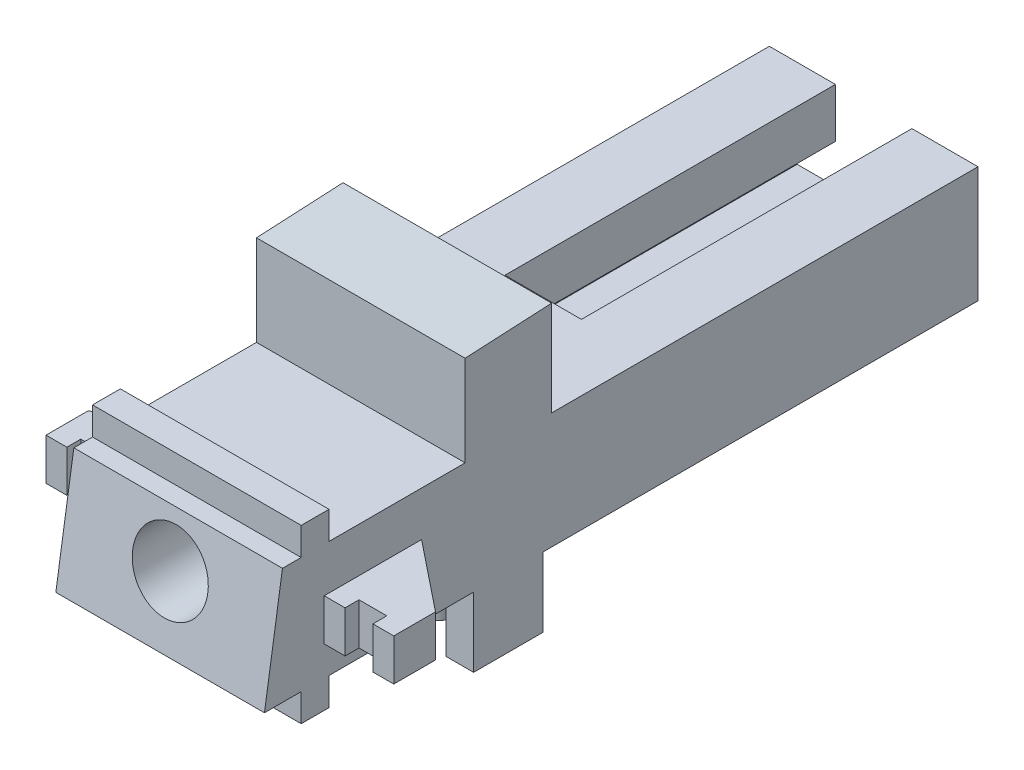
from build123d import *

# Parameters (mm, degrees)
SKETCH9_W               = 15
SKETCH9_H               = 8.35
BOSS_EXTRUDE4_DEPTH     = 50
CUT_EXTRUDE4_DEPTH      = 23.76
BOSS_EXTRUDE9_DEPTH     = 15
CUT_EXTRUDE5_REACH      = 31.734
SKETCH10_R              = 2.7
SKETCH12_W              = 3
SKETCH12_H              = 3
BOSS_EXTRUDE5_DEPTH     = 5
SKETCH13_W              = 2
SKETCH13_H              = 3
CUT_EXTRUDE6_DEPTH      = 1
BOSS_EXTRUDE6_DEPTH     = 3
SKETCH22_W              = 2
SKETCH22_H              = 2
BOSS_EXTRUDE10_DEPTH    = 15
CUT_EXTRUDE7_REACH      = 55.801
CUT_EXTRUDE7_END_RADIUS = 2.7
SKETCH23_R              = 2.5
SKETCH24_W              = 2
SKETCH24_H              = 5
BOSS_EXTRUDE11_DEPTH    = 5
BOSS_EXTRUDE12_DEPTH    = 15


with BuildPart() as part:
    # Sketch9 → Boss-Extrude4 (new body)
    with BuildSketch(Plane.XY):
        with Locations((0, 4.175)):
            Rectangle(SKETCH9_W, SKETCH9_H)
    extrude(amount=BOSS_EXTRUDE4_DEPTH)

    # Sketch7 → Cut-Extrude4 (cut)
    with BuildSketch(Plane.XY):
        Polygon((-5.5, 2), (-5.5, 4.8), (-2.75, 4.8), (-2.75, 8.35), (2.75, 8.35), (2.75, 4.8), (5.5, 4.8), (5.5, 2), align=None)
    extrude(amount=CUT_EXTRUDE4_DEPTH, mode=Mode.SUBTRACT)

    # Sketch21 → Boss-Extrude9 (add)
    with BuildSketch(Plane.ZY.offset(7.5)):
        Polygon((50, 0), (51.294730508, 0), (50, 8.35), align=None)
    extrude(amount=-BOSS_EXTRUDE9_DEPTH)

    # Cut-Extrude5: up to this plane
    cut_extrude5_end = Plane(origin=(15.949782665, 0, 51.294730508), z_dir=(0, 0.15322648630316937, 0.9881910968507989))
    # Sketch10 → Cut-Extrude5 (cut, up to the surface)
    with BuildSketch(Plane.XY.offset(23.76), mode=Mode.PRIVATE) as cut_extrude5_sk1:
        with Locations(Location((0, 4.7, 0), (0, 0, 270))):
            Circle(SKETCH10_R)
    cut_extrude5_tool1 = split(extrude(cut_extrude5_sk1.sketch, amount=CUT_EXTRUDE5_REACH, mode=Mode.PRIVATE), bisect_by=cut_extrude5_end, keep=Keep.BOTH, mode=Mode.PRIVATE)
    add(cut_extrude5_tool1.solids().sort_by_distance((0, 4.7, 23.76))[0], mode=Mode.SUBTRACT)

    # Sketch12 → Boss-Extrude5 (add)
    with BuildSketch(Plane(origin=(7.5, 0, 0), x_dir=(0, 0, -1), z_dir=(1, 0, 0))):
        with Locations((-45.5, 3.64)):
            Rectangle(SKETCH12_W, SKETCH12_H)
    boss_extrude5 = extrude(amount=BOSS_EXTRUDE5_DEPTH)

    # Sketch13 → Cut-Extrude6 (cut)
    with BuildSketch(Plane.XY.offset(47)):
        with Locations((10, 3.64)):
            Rectangle(SKETCH13_W, SKETCH13_H)
    cut_extrude6 = extrude(amount=-CUT_EXTRUDE6_DEPTH, mode=Mode.SUBTRACT)

    # Mirror2: Boss-Extrude5 across plane
    add(boss_extrude5.mirror(Plane(origin=(0, 0, 0), x_dir=(0, 0, 1), z_dir=(1, 0, 0))))

    # Mirror4: Cut-Extrude6 across plane
    add(cut_extrude6.mirror(Plane(origin=(0, 0, 0), x_dir=(0, 0, 1), z_dir=(1, 0, 0))), mode=Mode.SUBTRACT)

    # Sketch14 → Boss-Extrude6 (add)
    with BuildSketch(Plane(origin=(0, 5.14, 0), x_dir=(1, 0, 0), z_dir=(0, 1, 0))):
        Polygon((12.5, -44), (7.5, -40), (7.5, -44), align=None)
    boss_extrude6 = extrude(amount=-BOSS_EXTRUDE6_DEPTH)

    # Mirror5: Boss-Extrude6 across plane
    add(boss_extrude6.mirror(Plane(origin=(0, 0, 0), x_dir=(0, 0, 1), z_dir=(1, 0, 0))))

    # Sketch22 → Boss-Extrude10 (add)
    with BuildSketch(Plane.ZY.offset(7.5)):
        with Locations((47.655054804, -1)):
            Rectangle(SKETCH22_W, SKETCH22_H)
        with Locations((47.655054804, 9.35)):
            Rectangle(SKETCH22_W, SKETCH22_H)
    extrude(amount=-BOSS_EXTRUDE10_DEPTH)

    # Cut-Extrude7: up to this cylinder (the profile starts outside it)
    cut_extrude7_end = Plane(origin=(0, 4.7, 29.26), z_dir=(0, 0, -1)) * Cylinder(CUT_EXTRUDE7_END_RADIUS, 118.002, mode=Mode.PRIVATE)
    # Sketch23 → Cut-Extrude7 (cut, up to the surface)
    with BuildSketch(Plane.XZ, mode=Mode.PRIVATE) as cut_extrude7_sk1:
        with Locations(Location((0, 29.26, 0), (0, 0, 270))):
            Circle(SKETCH23_R)
    cut_extrude7_tool1 = extrude(cut_extrude7_sk1.sketch, amount=-CUT_EXTRUDE7_REACH, mode=Mode.PRIVATE) - cut_extrude7_end
    add(cut_extrude7_tool1.solids().sort_by_distance((0, 0, 29.26))[0], mode=Mode.SUBTRACT)

    # Sketch24 → Boss-Extrude11 (add)
    with BuildSketch(Plane.XZ):
        with Locations((6.5, 33.76)):
            Rectangle(SKETCH24_W, SKETCH24_H)
        with Locations((-6.5, 33.76)):
            Rectangle(SKETCH24_W, SKETCH24_H)
        with BuildLine():
            Line((2.5, 33.01), (-2.5, 33.01))
            ThreePointArc((-2.5, 33.01), (-3.25, 33.76), (-2.5, 34.51))
            Line((-2.5, 34.51), (2.5, 34.51))
            ThreePointArc((2.5, 34.51), (3.25, 33.76), (2.5, 33.01))
        make_face()
    extrude(amount=BOSS_EXTRUDE11_DEPTH)

    # Sketch25 → Boss-Extrude12 (add)
    with BuildSketch(Plane(origin=(7.5, 0, 0), x_dir=(0, 0, -1), z_dir=(1, 0, 0))):
        Polygon((-30.650366035, 8.35), (-36.869633965, 8.35), (-36.869633965, 14.862315517), (-30.650366035, 15.181595964), align=None)
    extrude(amount=-BOSS_EXTRUDE12_DEPTH)


solid = part.part
